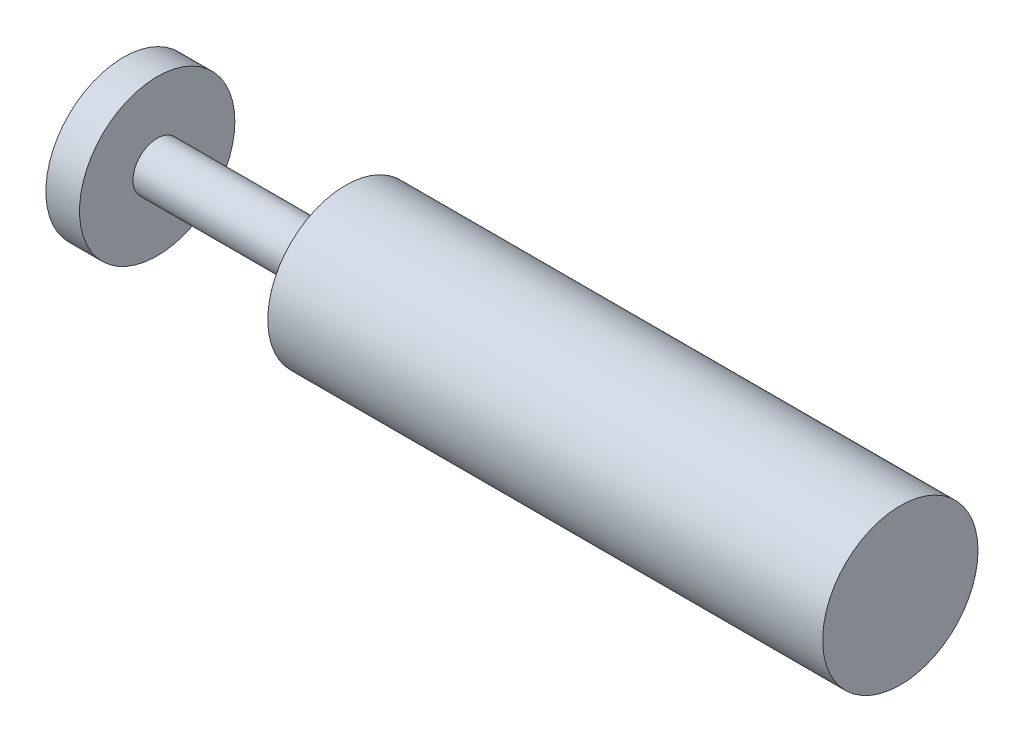
from build123d import *


with BuildPart() as part:
    # Sketch1 → Revolve1 (revolve)
    with BuildSketch(Plane(origin=(0, 0, 0), x_dir=(1, 0, 0), z_dir=(0, 1, 0))):
        Polygon((0, 0), (0, 7), (3.031847134, 7), (3.031847134, 2.184713376), (20, 2.184713376), (20, 7), (70, 7), (70, 0), align=None)
    revolve(axis=Axis((70, 0, 0), (-1, 0, 0)))


solid = part.part
